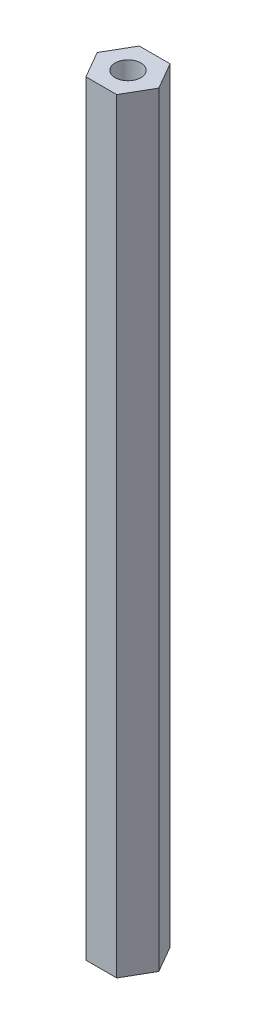
from build123d import *

# Parameters (mm, degrees)
BOSS_EXTRUDE1_DEPTH = 74.5
SKETCH2_R           = 1.25
CUT_EXTRUDE1_DEPTH  = 75.605629814


with BuildPart() as part:
    # Sketch1 → Boss-Extrude1 (new body)
    with BuildSketch(Plane(origin=(0, 0, 0), x_dir=(1, 0, 0), z_dir=(0, 1, 0))):
        Polygon((1.5, 2.598076211), (-1.5, 2.598076211), (-3, 0), (-1.5, -2.598076211), (1.5, -2.598076211), (3, 0), align=None)
    extrude(amount=BOSS_EXTRUDE1_DEPTH)

    # Sketch2 → Cut-Extrude1 (cut, through all)
    with BuildSketch(Plane(origin=(0, 74.5, 0), x_dir=(1, 0, 0), z_dir=(0, 1, 0))):
        with Locations(Location((0, 0, 0), (0, 0, 270))):
            Circle(SKETCH2_R)
    extrude(amount=-CUT_EXTRUDE1_DEPTH, mode=Mode.SUBTRACT)


solid = part.part
